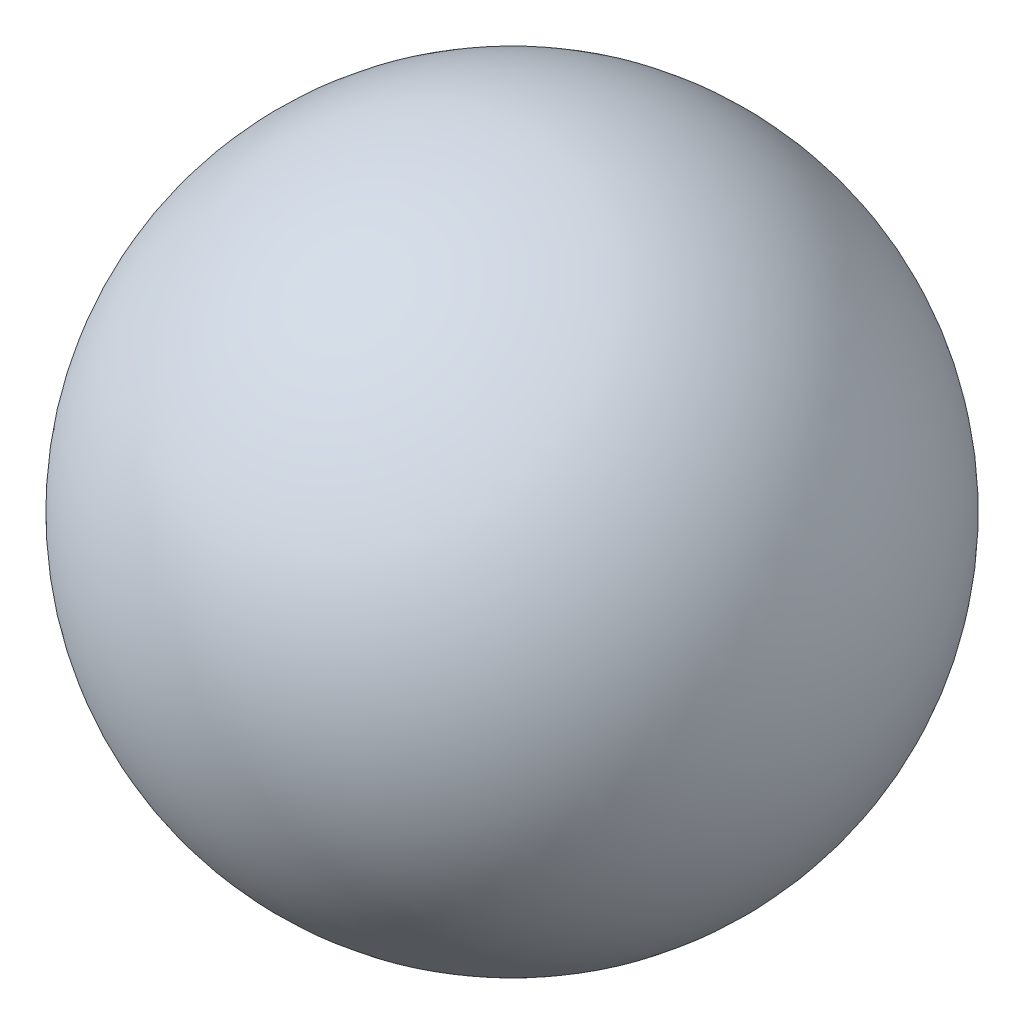
from build123d import *
from build123d.topology import SkipClean

# Parameters (mm, degrees)
SHELL1_T = 0.4


with BuildPart() as part:
    # Sketch1 → Revolve2 (revolve)
    with SkipClean():  # the faces are left unmerged after this step: merging them gives an invalid solid
        with BuildSketch(Plane.XY):
            with BuildLine():
                ThreePointArc((20, 0), (14.142135624, 14.142135624), (0, 20))
                Line((0, 20), (0, -20))
                ThreePointArc((0, -20), (14.142135624, -14.142135624), (20, 0))
            make_face()
            with BuildLine():
                Line((0, -20), (0, 20))
                ThreePointArc((0, 20), (-20, 0), (0, -20))
            make_face()
        revolve(axis=Axis((0, 20, 0), (0, -1, 0)))

    # Shell1 (no face opened: a closed hollow body)
    add(offset(amount=-SHELL1_T, mode=Mode.PRIVATE), mode=Mode.SUBTRACT)


solid = part.part
